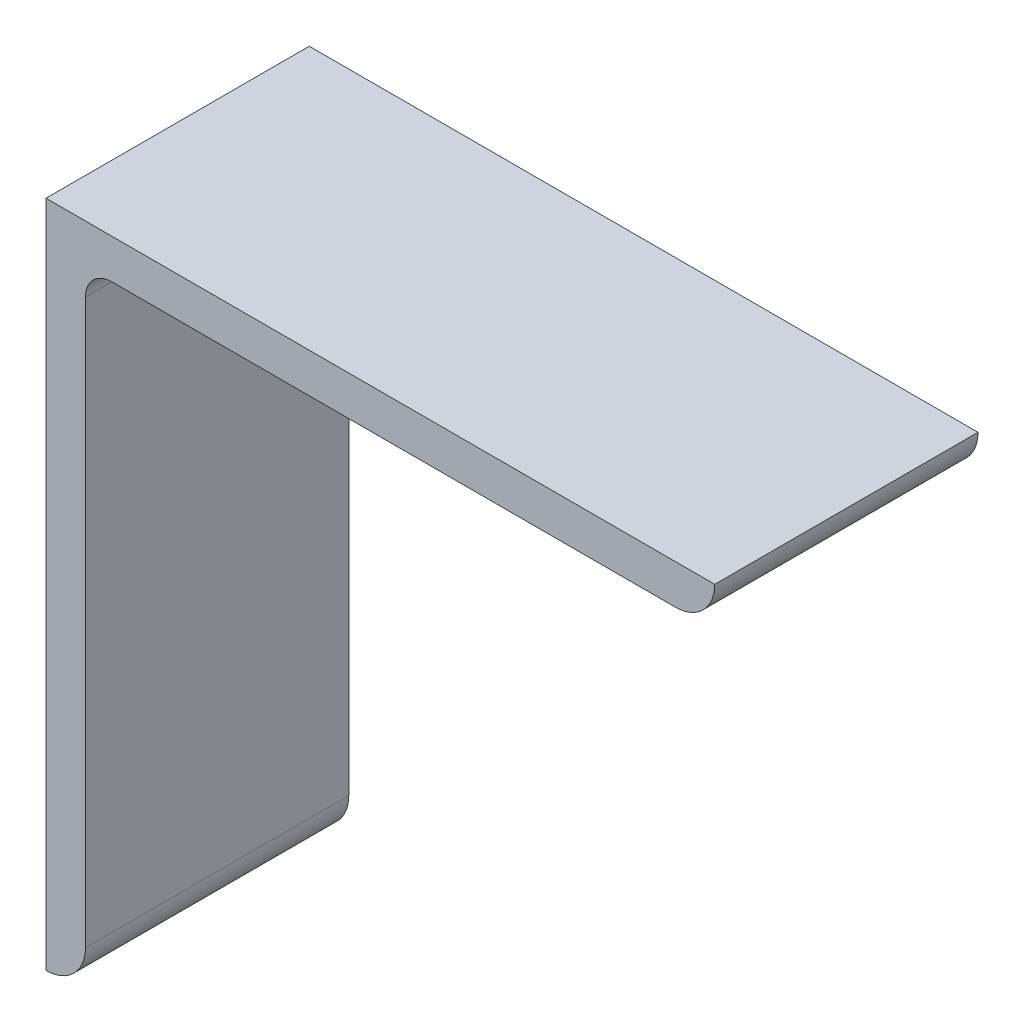
from build123d import *

# Parameters (mm, degrees)
SALIENTE_EXTRUIR1_DEPTH = 20


with BuildPart() as part:
    # Croquis1 → Saliente-Extruir1 (new body)
    with BuildSketch(Plane.XY):
        with BuildLine():
            Line((22.208537854, 22.208537854), (-20.591462146, 22.208537854))
            ThreePointArc((-20.591462146, 22.208537854), (-22.005675708, 21.622751417), (-22.591462146, 20.208537854))
            Line((-22.591462146, 20.208537854), (-22.591462146, -22.591462146))
            ThreePointArc((-22.591462146, -22.591462146), (-23.470141802, -24.712782489), (-25.591462146, -25.591462146))
            Line((-25.591462146, -25.591462146), (-25.591462146, 25.208537854))
            Line((-25.591462146, 25.208537854), (25.208537854, 25.208537854))
            ThreePointArc((25.208537854, 25.208537854), (24.329858198, 23.087217511), (22.208537854, 22.208537854))
        make_face()
    extrude(amount=SALIENTE_EXTRUIR1_DEPTH)


solid = part.part
